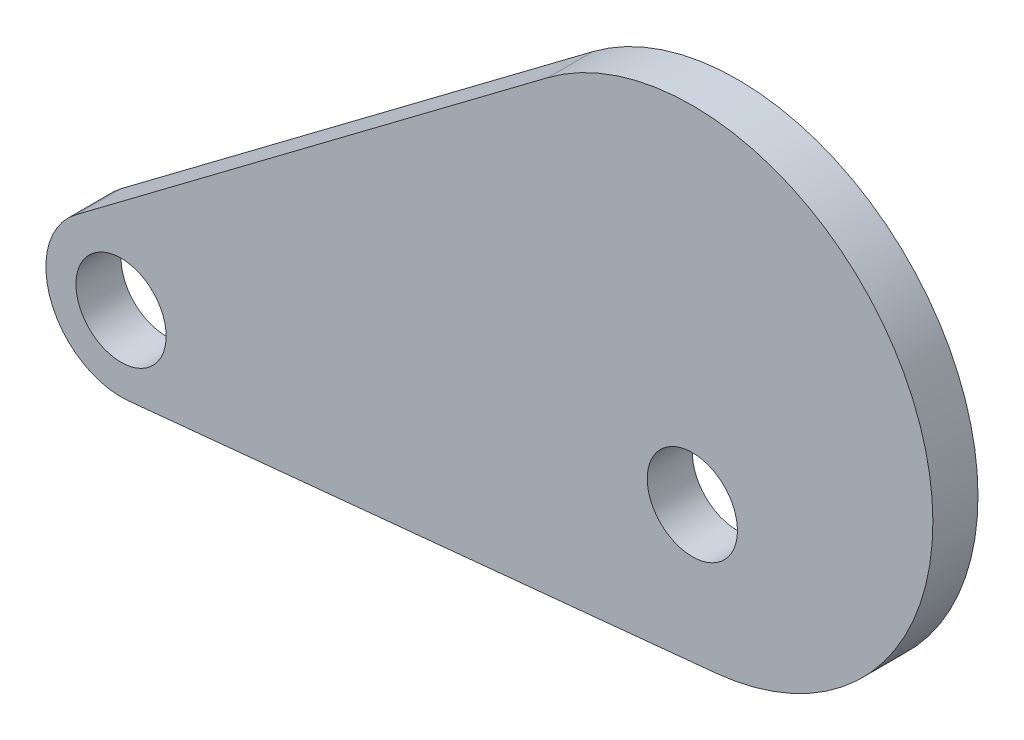
from build123d import *

# Parameters (mm, degrees)
SKETCH_1_R      = 3
EXTRUDE_1_DEPTH = 3


with BuildPart() as part:
    # ｽｹｯﾁ1 → ﾎﾞｽ - 押し出し1 (new body)
    with BuildSketch(Plane.XY):
        with BuildLine():
            Line((9.386968503, 23.690216005), (-22.004072343, 0.096942501))
            ThreePointArc((-22.004072343, 0.096942501), (-23.659102375, -5.714597767), (-18.509396967, -8.875872653))
            Line((-18.509396967, -8.875872653), (20.569929707, -5.022792491))
            ThreePointArc((20.569929707, -5.022792491), (33.909127601, 16.706712855), (9.386968503, 23.690216005))
        make_face()
        with Locations((-19, -3.9)):
            Circle(SKETCH_1_R, mode=Mode.SUBTRACT)
        with Locations((19, 3.9)):
            Circle(SKETCH_1_R, mode=Mode.SUBTRACT)
    extrude(amount=EXTRUDE_1_DEPTH)


solid = part.part
